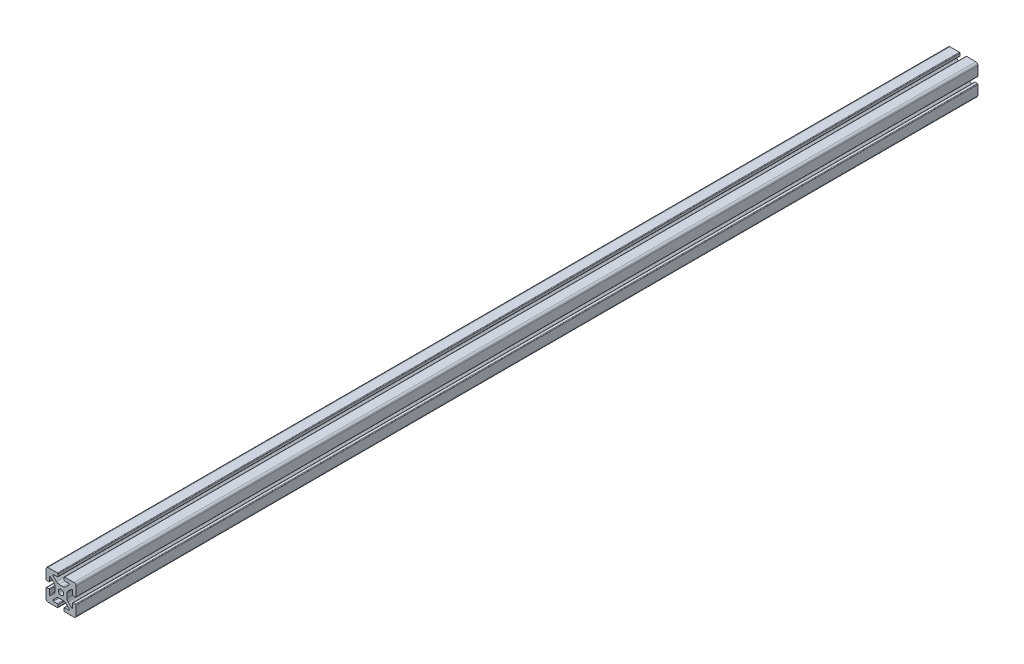
from build123d import *

# Parameters (mm, degrees)
SKETCH1_R           = 3.5
BOSS_EXTRUDE1_DEPTH = 600


with BuildPart() as part:
    # Sketch1 → Boss-Extrude1 (new, symmetric)
    with BuildSketch(Plane.XY):
        with BuildLine():
            Line((4.8, -20), (17.2, -20))
            ThreePointArc((17.2, -20), (19.179898987, -19.179898987), (20, -17.2))
            Line((20, -17.2), (20, -4.8))
            ThreePointArc((20, -4.8), (19.765685425, -4.234314575), (19.2, -4))
            Line((19.2, -4), (16.190663761, -4))
            ThreePointArc((16.190663761, -4), (15.624978336, -4.234314575), (15.390663761, -4.8))
            Line((15.390663761, -4.8), (15.390663761, -10.2))
            ThreePointArc((15.390663761, -10.2), (14.896810507, -10.939103626), (14.024978336, -10.765685425))
            Line((14.024978336, -10.765685425), (9.40588745, -6.146594539))
            ThreePointArc((9.40588745, -6.146594539), (8.365378244, -4.589362465), (8, -2.752481989))
            Line((8, -2.752481989), (8, 2.752481989))
            ThreePointArc((8, 2.752481989), (8.365378244, 4.589362465), (9.40588745, 6.146594539))
            Line((9.40588745, 6.146594539), (14.024978336, 10.765685425))
            ThreePointArc((14.024978336, 10.765685425), (14.896810507, 10.939103626), (15.390663761, 10.2))
            Line((15.390663761, 10.2), (15.390663761, 4.8))
            ThreePointArc((15.390663761, 4.8), (15.624978336, 4.234314575), (16.190663761, 4))
            Line((16.190663761, 4), (19.2, 4))
            ThreePointArc((19.2, 4), (19.765685425, 4.234314575), (20, 4.8))
            Line((20, 4.8), (20, 17.2))
            ThreePointArc((20, 17.2), (19.179898987, 19.179898987), (17.2, 20))
            Line((17.2, 20), (4.8, 20))
            ThreePointArc((4.8, 20), (4.234314575, 19.765685425), (4, 19.2))
            Line((4, 19.2), (4, 16.190663761))
            ThreePointArc((4, 16.190663761), (4.234314575, 15.624978336), (4.8, 15.390663761))
            Line((4.8, 15.390663761), (10.2, 15.390663761))
            ThreePointArc((10.2, 15.390663761), (10.939103626, 14.896810507), (10.765685425, 14.024978336))
            Line((10.765685425, 14.024978336), (6.146594539, 9.40588745))
            ThreePointArc((6.146594539, 9.40588745), (4.589362465, 8.365378244), (2.752481989, 8))
            Line((2.752481989, 8), (-2.752481989, 8))
            ThreePointArc((-2.752481989, 8), (-4.589362465, 8.365378244), (-6.146594539, 9.40588745))
            Line((-6.146594539, 9.40588745), (-10.765685425, 14.024978336))
            ThreePointArc((-10.765685425, 14.024978336), (-10.939103626, 14.896810507), (-10.2, 15.390663761))
            Line((-10.2, 15.390663761), (-4.8, 15.390663761))
            ThreePointArc((-4.8, 15.390663761), (-4.234314575, 15.624978336), (-4, 16.190663761))
            Line((-4, 16.190663761), (-4, 19.2))
            ThreePointArc((-4, 19.2), (-4.234314575, 19.765685425), (-4.8, 20))
            Line((-4.8, 20), (-17.2, 20))
            ThreePointArc((-17.2, 20), (-19.179898987, 19.179898987), (-20, 17.2))
            Line((-20, 17.2), (-20, 4.8))
            ThreePointArc((-20, 4.8), (-19.765685425, 4.234314575), (-19.2, 4))
            Line((-19.2, 4), (-16.190663761, 4))
            ThreePointArc((-16.190663761, 4), (-15.624978336, 4.234314575), (-15.390663761, 4.8))
            Line((-15.390663761, 4.8), (-15.390663761, 10.2))
            ThreePointArc((-15.390663761, 10.2), (-14.896810507, 10.939103626), (-14.024978336, 10.765685425))
            Line((-14.024978336, 10.765685425), (-9.40588745, 6.146594539))
            ThreePointArc((-9.40588745, 6.146594539), (-8.365378244, 4.589362465), (-8, 2.752481989))
            Line((-8, 2.752481989), (-8, -2.752481989))
            ThreePointArc((-8, -2.752481989), (-8.365378244, -4.589362465), (-9.40588745, -6.146594539))
            Line((-9.40588745, -6.146594539), (-14.024978336, -10.765685425))
            ThreePointArc((-14.024978336, -10.765685425), (-14.896810507, -10.939103626), (-15.390663761, -10.2))
            Line((-15.390663761, -10.2), (-15.390663761, -4.8))
            ThreePointArc((-15.390663761, -4.8), (-15.624978336, -4.234314575), (-16.190663761, -4))
            Line((-16.190663761, -4), (-19.2, -4))
            ThreePointArc((-19.2, -4), (-19.765685425, -4.234314575), (-20, -4.8))
            Line((-20, -4.8), (-20, -17.2))
            ThreePointArc((-20, -17.2), (-19.179898987, -19.179898987), (-17.2, -20))
            Line((-17.2, -20), (-4.8, -20))
            ThreePointArc((-4.8, -20), (-4.234314575, -19.765685425), (-4, -19.2))
            Line((-4, -19.2), (-4, -16.190663761))
            ThreePointArc((-4, -16.190663761), (-4.234314575, -15.624978336), (-4.8, -15.390663761))
            Line((-4.8, -15.390663761), (-10.2, -15.390663761))
            ThreePointArc((-10.2, -15.390663761), (-10.939103626, -14.896810507), (-10.765685425, -14.024978336))
            Line((-10.765685425, -14.024978336), (-6.146594539, -9.40588745))
            ThreePointArc((-6.146594539, -9.40588745), (-4.589362465, -8.365378244), (-2.752481989, -8))
            Line((-2.752481989, -8), (2.752481989, -8))
            ThreePointArc((2.752481989, -8), (4.589362465, -8.365378244), (6.146594539, -9.40588745))
            Line((6.146594539, -9.40588745), (10.765685425, -14.024978336))
            ThreePointArc((10.765685425, -14.024978336), (10.939103626, -14.896810507), (10.2, -15.390663761))
            Line((10.2, -15.390663761), (4.8, -15.390663761))
            ThreePointArc((4.8, -15.390663761), (4.234314575, -15.624978336), (4, -16.190663761))
            Line((4, -16.190663761), (4, -19.2))
            ThreePointArc((4, -19.2), (4.234314575, -19.765685425), (4.8, -20))
        make_face()
        Circle(SKETCH1_R, mode=Mode.SUBTRACT)
    extrude(amount=BOSS_EXTRUDE1_DEPTH, both=True)


solid = part.part
